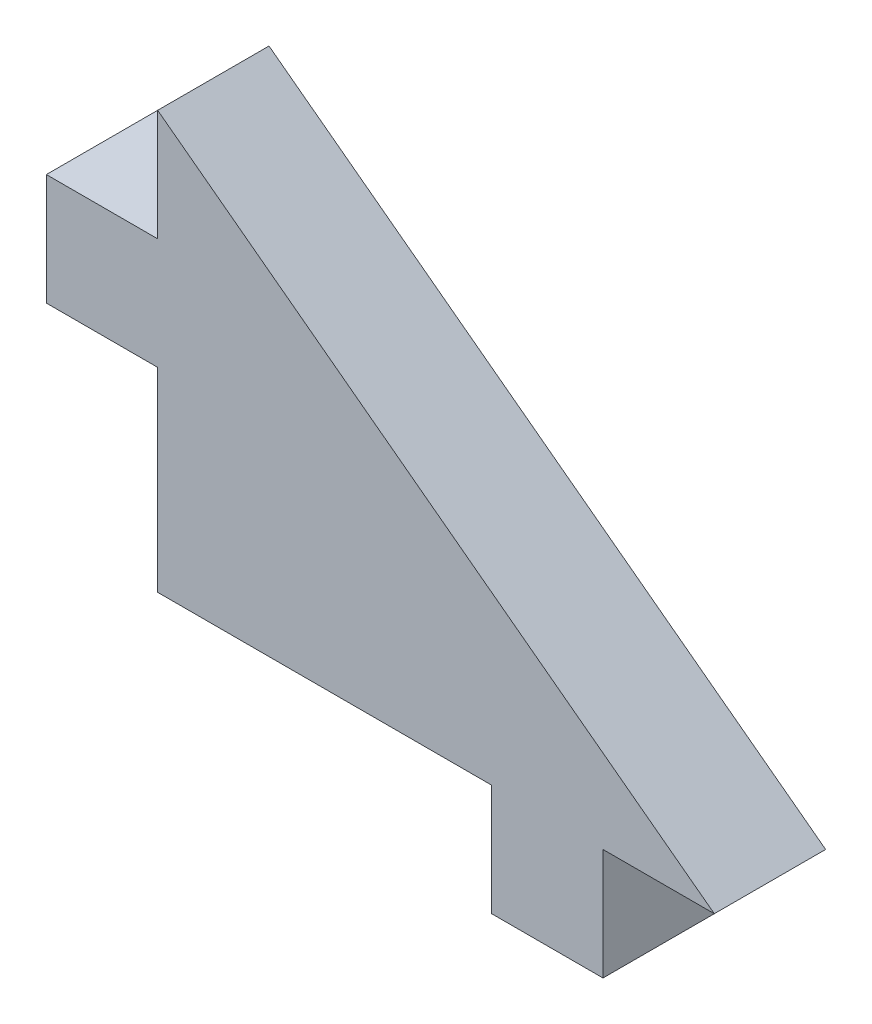
from build123d import *

# Parameters (mm, degrees)
SIDE_BOSS_EXTRUDE1_DEPTH               = 8
SKETCH2_W                              = 8
SKETCH2_H                              = 8
PUZZLE_SLOT_BACK_BOSS_EXTRUDE2_DEPTH   = 8
SKETCH3_W                              = 8
SKETCH3_H                              = 8
PUZZLE_SLOT_BOTTOM_BOSS_EXTRUDE3_DEPTH = 8


with BuildPart() as part:
    # Sketch1 → Side Boss-Extrude1 (new body)
    with BuildSketch(Plane.XY):
        Polygon((0, 0), (0, 30), (40, 0), align=None)
    extrude(amount=SIDE_BOSS_EXTRUDE1_DEPTH)

    # Sketch2 → Puzzle Slot Back Boss-Extrude2 (add)
    with BuildSketch(Plane.ZY):
        with Locations((4, 18)):
            Rectangle(SKETCH2_W, SKETCH2_H)
    extrude(amount=PUZZLE_SLOT_BACK_BOSS_EXTRUDE2_DEPTH)

    # Sketch3 → Puzzle Slot Bottom Boss-Extrude3 (add)
    with BuildSketch(Plane.XZ):
        with Locations((28, 4)):
            Rectangle(SKETCH3_W, SKETCH3_H)
    extrude(amount=PUZZLE_SLOT_BOTTOM_BOSS_EXTRUDE3_DEPTH)


solid = part.part
